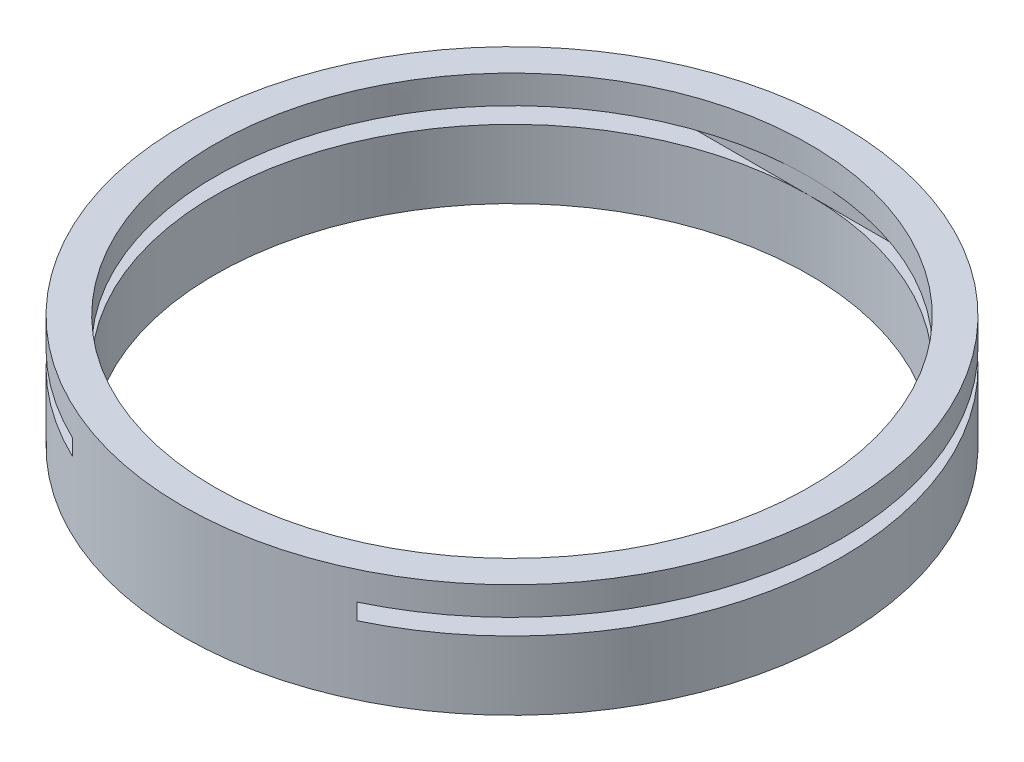
from build123d import *

# Parameters (mm, degrees)
SKETCH1_R               = 20.4
SKETCH1_R_2             = 18.4
BOSS_EXTRUDE1_DEPTH     = 7
CUT_EXTRUDE1_DEPTH      = 31
CUT_EXTRUDE1_DEPTH_BACK = 29
SKETCH5_W               = 36.8
SKETCH5_H               = 1


with BuildPart() as part:
    # Sketch1 → Boss-Extrude1 (new body)
    with BuildSketch(Plane(origin=(0, 0, 0), x_dir=(1, 0, 0), z_dir=(0, 1, 0))):
        with Locations(Location((0, 0, 0), (0, 0, 270))):
            Circle(SKETCH1_R)
        with Locations(Location((0, 0, 0), (0, 0, 270))):
            Circle(SKETCH1_R_2, mode=Mode.SUBTRACT)
    extrude(amount=BOSS_EXTRUDE1_DEPTH)

    # Sketch5 → Cut-Extrude1 (cut, two sides: drawn at the far end of the back side and taken through both)
    with BuildSketch(Plane(origin=(0, 0, 0), x_dir=(0, 0, -1), z_dir=(1, 0, 0)).offset(-CUT_EXTRUDE1_DEPTH_BACK)):
        with Locations((0, 4.75)):
            Rectangle(SKETCH5_W, SKETCH5_H)
    extrude(amount=CUT_EXTRUDE1_DEPTH + CUT_EXTRUDE1_DEPTH_BACK, mode=Mode.SUBTRACT)


solid = part.part
